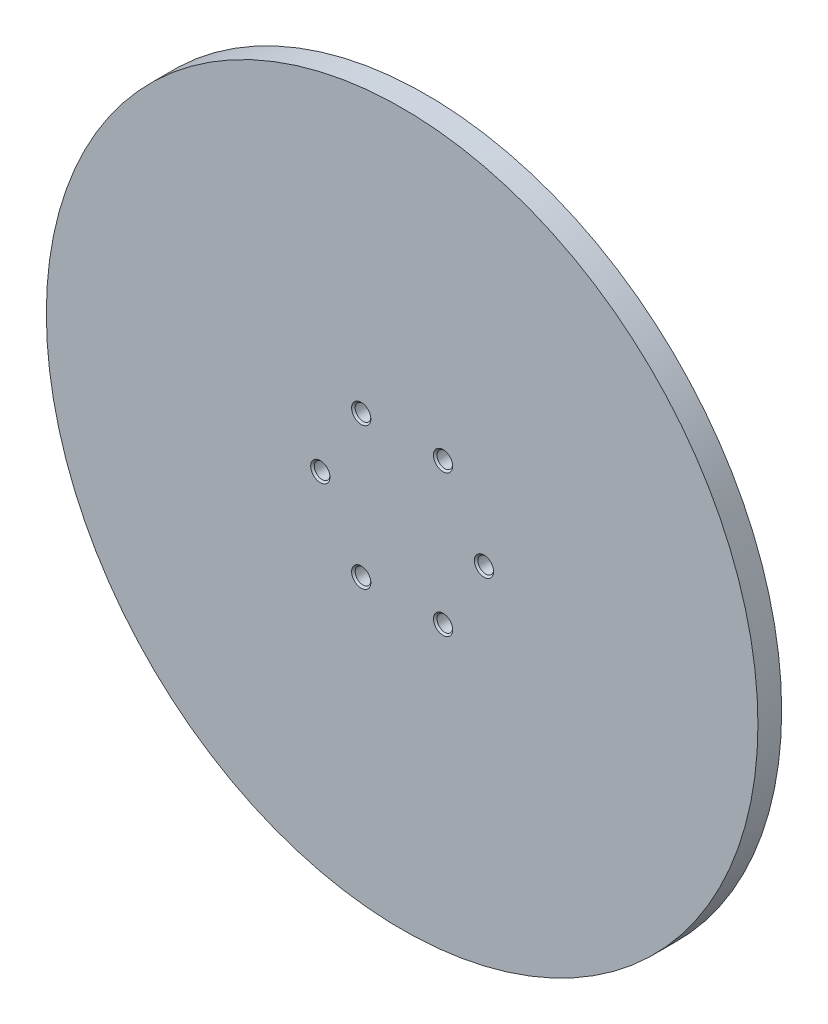
from build123d import *

# Parameters (mm, degrees)
SKETCH_1_R                   = 75
SKETCH_1_R_2                 = 17.25
EXTRUDE_1_DEPTH              = 5
EXTRUDE_START                = -5
SKETCH_2_R                   = 17.25
EXTRUDE_2_DEPTH              = 5
HOLE_WIZARD_M4_5_D           = 3.3
HOLE_WIZARD_M4_5_CSINK_D     = 4.05
HOLE_WIZARD_M4_5_CSINK_ANGLE = 90
PATTERN_CIRCULAR_1_COUNT     = 6


with BuildPart() as part:
    # 草图1 → 凸台-拉伸1 (new body)
    with BuildSketch(Plane.XY):
        with Locations((-61.833180774, 36.701596564)):
            Circle(SKETCH_1_R)
        with Locations((-61.833180774, 36.701596564)):
            Circle(SKETCH_1_R_2, mode=Mode.SUBTRACT)
    extrude(amount=EXTRUDE_1_DEPTH)

    # 草图2 → 凸台-拉伸2 (add)
    with BuildSketch(Plane.XY.offset(5).offset(EXTRUDE_START)):
        with Locations((-61.833180774, 36.701596564)):
            Circle(SKETCH_2_R)
    extrude(amount=EXTRUDE_2_DEPTH)

    # M4 螺纹孔5 (through all)
    with Locations(Plane.XY.offset(5)):
        with Locations((-79.083180774, 36.701596564)):
            hole_wizard_m4_5 = CounterSinkHole(HOLE_WIZARD_M4_5_D / 2, HOLE_WIZARD_M4_5_CSINK_D / 2, counter_sink_angle=HOLE_WIZARD_M4_5_CSINK_ANGLE)

    # 阵列(圆周)1: M4 螺纹孔5 ×6 about axis
    pattern_circular_1_axis = Axis((-61.833180774, 36.701596564, 0), (0, 0, 1))
    for i in range(1, PATTERN_CIRCULAR_1_COUNT):
        add(hole_wizard_m4_5.rotate(pattern_circular_1_axis, i * 360 / PATTERN_CIRCULAR_1_COUNT), mode=Mode.SUBTRACT)


solid = part.part
